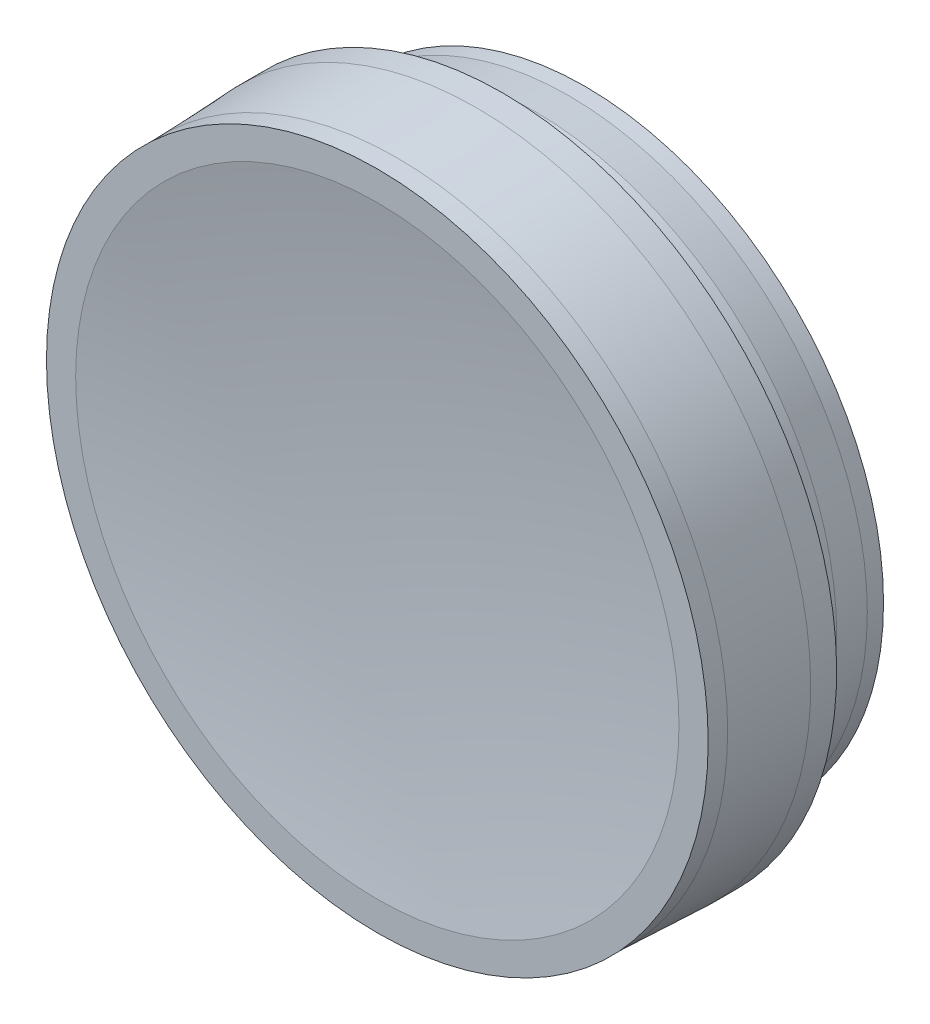
from build123d import *


with BuildPart() as part:
    # Sketch1 → Revolve1 (revolve)
    with BuildSketch(Plane(origin=(0, 0, 0), x_dir=(0, 0, -1), z_dir=(1, 0, 0))):
        with BuildLine():
            Line((-1.445971311, 4.65), (-1.445971311, 5.15))
            Line((-1.445971311, 5.15), (-1.845971311, 5.15))
            Line((-1.845971311, 5.15), (-3.076316722, 5.1))
            Line((-3.076316722, 5.1), (-3.376316722, 5.1))
            Line((-3.376316722, 5.1), (-3.376316722, 4.65))
            ThreePointArc((-3.376316722, 4.65), (-3.094232719, 2.332601245), (-3, 0))
            Line((-3, 0), (0, 0))
            add(Edge.make_bspline(
                [(0, 0), (-2.675e-06, 0.01666667), (-8.026e-06, 0.050000025), (-8.7895e-05, 0.100000022), (-0.000180393, 0.150000063), (-0.000330536, 0.200000094), (-0.000537467, 0.250000053), (-0.000759597, 0.300000137), (-0.001044147, 0.350000117), (-0.001363821, 0.400000131), (-0.001720577, 0.450000201), (-0.00213388, 0.500000168), (-0.00258391, 0.550000181), (-0.003070489, 0.60000027), (-0.003614151, 0.650000216), (-0.004192925, 0.700000245), (-0.004814168, 0.750000245), (-0.005470422, 0.80000036), (-0.006184171, 0.850000281), (-0.006932922, 0.900000314), (-0.007724172, 0.95000031), (-0.008550424, 1.000000449), (-0.009434173, 1.050000346), (-0.010352924, 1.100000384), (-0.011314174, 1.150000375), (-0.012310428, 1.200000538), (-0.013364176, 1.250000411), (-0.014452926, 1.300000453), (-0.015584178, 1.35000044), (-0.016750427, 1.400000627), (-0.017974197, 1.450000475), (-0.019232861, 1.500000524), (-0.020534438, 1.550000498), (-0.021869472, 1.600000744), (-0.023267779, 1.650000343), (-0.024679493, 1.700000784), (-0.026154367, 1.750000567), (-0.027663148, 1.800000617), (-0.029213151, 1.850000635), (-0.030804364, 1.900000609), (-0.03242952, 1.9500009), (-0.034117709, 2.000000417), (-0.035819762, 2.050000932), (-0.037583409, 2.100000712), (-0.039386752, 2.150000479), (-0.041209716, 2.200000999), (-0.043094579, 2.250000713), (-0.045012147, 2.300000823), (-0.046977008, 2.350000513), (-0.048959975, 2.400001074), (-0.051003318, 2.450000827), (-0.053086955, 2.500000545), (-0.055189036, 2.55000118), (-0.057357151, 2.60000056), (-0.059542551, 2.650000917), (-0.061772874, 2.700000922), (-0.064046189, 2.750000631), (-0.06634257, 2.800000963), (-0.068683782, 2.850000923), (-0.071062569, 2.900000997), (-0.073486209, 2.950000672), (-0.075932824, 3.000001012), (-0.078422781, 3.050001033), (-0.080956347, 3.100000695), (-0.083512081, 3.150001096), (-0.086115631, 3.200000753), (-0.088745651, 3.250000758), (-0.091402026, 3.300001143), (-0.09410657, 3.350000729), (-0.096831979, 3.400001174), (-0.099605857, 3.450000789), (-0.102404883, 3.500000851), (-0.105234896, 3.55000086), (-0.108095823, 3.600000814), (-0.110982119, 3.650001235), (-0.113916085, 3.70000082), (-0.116873864, 3.750000961), (-0.119868764, 3.800000474), (-0.122871331, 3.850001333), (-0.125926314, 3.90000084), (-0.129003762, 3.950001006), (-0.132118968, 4.00000048), (-0.135240638, 4.05000143), (-0.1384189, 4.100000495), (-0.141604042, 4.150001022), (-0.144825285, 4.200000953), (-0.148075192, 4.250000967), (-0.151354329, 4.300001033), (-0.154667867, 4.350000584), (-0.157994497, 4.400001036), (-0.16135453, 4.450001045), (-0.164747775, 4.500000605), (-0.168111531, 4.549367846), (-0.170360364, 4.582067388), (-0.17146867, 4.598100522)],
                knots=[0, 0, 0, 0, 0.010742815, 0.02148564, 0.032228476, 0.042971338, 0.053714238, 0.064457166, 0.075200149, 0.085943183, 0.096686276, 0.107429451, 0.118172701, 0.128916031, 0.139659472, 0.150403009, 0.161146649, 0.171890399, 0.182634296, 0.193378319, 0.204122474, 0.214866768, 0.225611246, 0.236355879, 0.247100673, 0.257845636, 0.268590819, 0.279336185, 0.290081743, 0.300827498, 0.311573509, 0.322319734, 0.333066179, 0.34381285, 0.354559815, 0.365306961, 0.376054417, 0.386802129, 0.397550104, 0.408298349, 0.41904687, 0.429795747, 0.440544842, 0.451294309, 0.462044083, 0.47279409, 0.483544495, 0.494295227, 0.505046292, 0.515797611, 0.526549363, 0.537301469, 0.548053845, 0.558806679, 0.569559793, 0.580313286, 0.591067166, 0.60182134, 0.612575913, 0.62333089, 0.63408628, 0.644841984, 0.655598111, 0.666354669, 0.677111555, 0.687868884, 0.698626549, 0.709384555, 0.720143021, 0.730901836, 0.741661123, 0.752420769, 0.763180777, 0.773941152, 0.784701896, 0.79546314, 0.806224762, 0.816986768, 0.827749031, 0.838511813, 0.84927499, 0.860038566, 0.870802409, 0.881566792, 0.892331448, 0.903096516, 0.913862001, 0.924627905, 0.935394234, 0.946160847, 0.95692789, 0.967695368, 0.978463137, 0.988822257, 0.988822257, 0.988822257, 0.988822257], degree=3))
            Line((-0.17146867, 4.598100522), (-0.42146867, 4.598100522))
            Line((-0.42146867, 4.598100522), (-0.945971311, 4.65))
            Line((-0.945971311, 4.65), (-1.445971311, 4.65))
        make_face()
    revolve(axis=Axis((0, 0, -5.189127774), (0, 0, 1)))


solid = part.part
